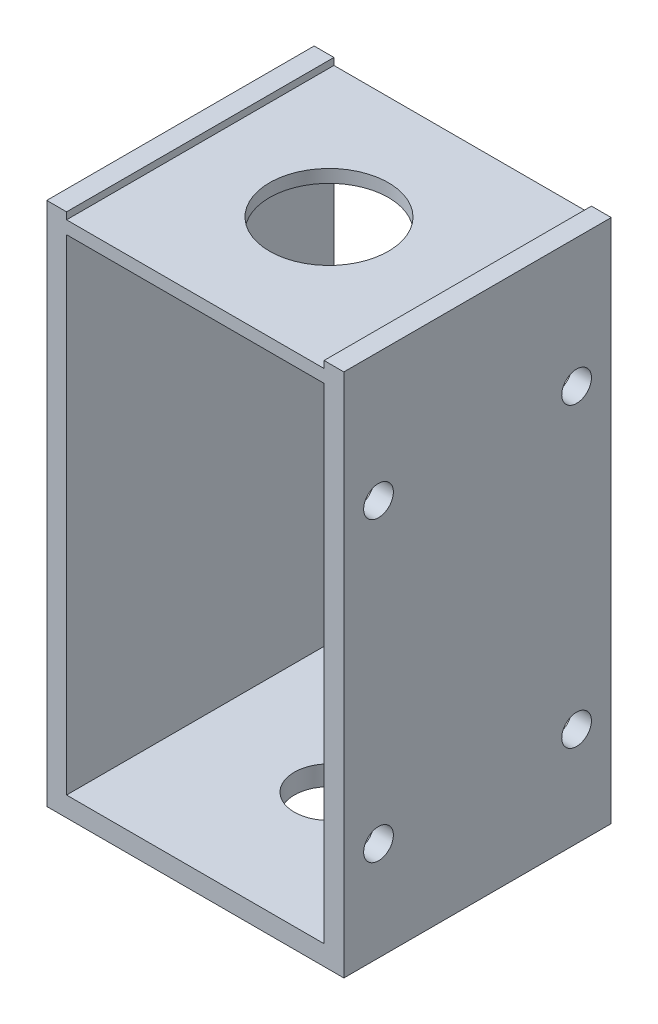
from build123d import *

# Parameters (mm, degrees)
SKETCH_2_W          = 30
SKETCH_2_H          = 53
SKETCH_2_W_2        = 26
SKETCH_2_H_2        = 49
EXTRUDE_1_DEPTH     = 27
SKETCH_3_W          = 26
SKETCH_3_H          = 27
CUT_EXTRUDE_1_DEPTH = 0.7
SKETCH_4_R          = 3.5
CUT_EXTRUDE_2_DEPTH = 38
SKETCH_5_R          = 1.5
CUT_EXTRUDE_3_DEPTH = 3
SKETCH_6_R          = 6
CUT_EXTRUDE_4_DEPTH = 3


with BuildPart() as part:
    # 草图2 → 拉伸-薄壁1 (new body)
    with BuildSketch(Plane.XY):
        Rectangle(SKETCH_2_W, SKETCH_2_H)
        Rectangle(SKETCH_2_W_2, SKETCH_2_H_2, mode=Mode.SUBTRACT)
    extrude(amount=EXTRUDE_1_DEPTH)

    # 草图3 → 切除-拉伸1 (cut)
    with BuildSketch(Plane(origin=(0, 26.5, 0), x_dir=(1, 0, 0), z_dir=(0, 1, 0))):
        with Locations((0, -13.5)):
            Rectangle(SKETCH_3_W, SKETCH_3_H)
    extrude(amount=-CUT_EXTRUDE_1_DEPTH, mode=Mode.SUBTRACT)

    # 草图4 → 切除-拉伸2 (cut)
    with BuildSketch(Plane.XZ.offset(26.5)):
        with Locations(Location((0, 13.5, 0), (0, 0, 270))):
            Circle(SKETCH_4_R)
    extrude(amount=-CUT_EXTRUDE_2_DEPTH, mode=Mode.SUBTRACT)

    # 草图5 → 切除-拉伸3 (cut)
    with BuildSketch(Plane(origin=(15, 0, 0), x_dir=(0, 0, -1), z_dir=(1, 0, 0))):
        with Locations(Location((-3.5, -16.5, 0), (0, 0, 90))):
            Circle(SKETCH_5_R)
        with Locations(Location((-3.5, 13.5, 0), (0, 0, 90))):
            Circle(SKETCH_5_R)
        with Locations(Location((-23.5, -16.5, 0), (0, 0, 270))):
            Circle(SKETCH_5_R)
        with Locations(Location((-23.5, 13.5, 0), (0, 0, 270))):
            Circle(SKETCH_5_R)
    extrude(amount=-CUT_EXTRUDE_3_DEPTH, mode=Mode.SUBTRACT)

    # 草图6 → 切除-拉伸4 (cut)
    with BuildSketch(Plane(origin=(0, 25.8, 0), x_dir=(1, 0, 0), z_dir=(0, 1, 0))):
        with Locations(Location((0, -13.5, 0), (0, 0, 270))):
            Circle(SKETCH_6_R)
    extrude(amount=-CUT_EXTRUDE_4_DEPTH, mode=Mode.SUBTRACT)


solid = part.part
